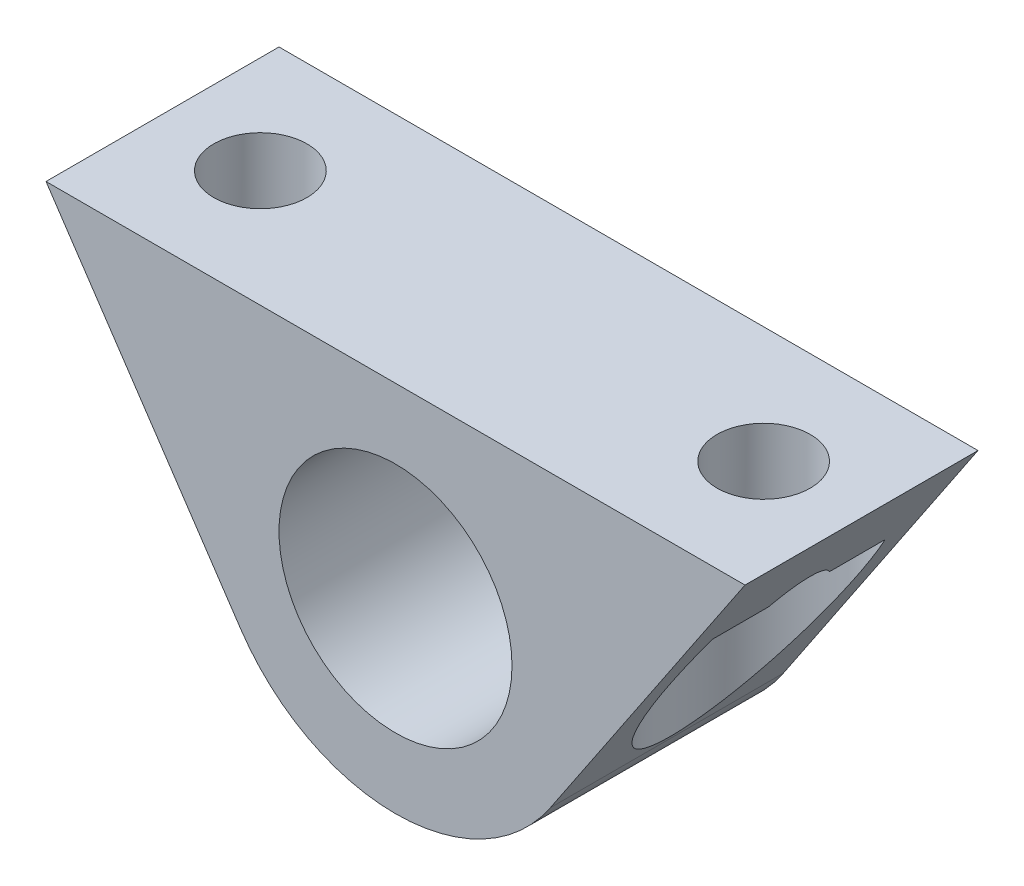
from build123d import *

# Parameters (mm, degrees)
SKETCH1_R           = 2.5
BOSS_EXTRUDE1_DEPTH = 5
CUT_EXTRUDE1_START  = -2
SKETCH2_R           = 2
SKETCH2_R_2         = 1
CUT_EXTRUDE1_DEPTH  = 11.051970793
SKETCH2_2_R         = 1
CUT_EXTRUDE2_DEPTH  = 13.051970793


with BuildPart() as part:
    # Sketch1 → Boss-Extrude1 (new body)
    with BuildSketch(Plane.XY):
        with BuildLine():
            Line((-7.5, 4), (7.5, 4))
            Line((7.5, 4), (3.321799308, -2.228373702))
            ThreePointArc((3.321799308, -2.228373702), (0, -4), (-3.321799308, -2.228373702))
            Line((-3.321799308, -2.228373702), (-7.5, 4))
        make_face()
        Circle(SKETCH1_R, mode=Mode.SUBTRACT)
    extrude(amount=BOSS_EXTRUDE1_DEPTH)

    # Sketch2 → Cut-Extrude1 (cut, through all)
    # profile 1 of 2: a face of its own
    with BuildSketch(Plane(origin=(0, 4, 0), x_dir=(1, 0, 0), z_dir=(0, 1, 0)).offset(CUT_EXTRUDE1_START)):
        with Locations((-5.4, -2.5)):
            Circle(SKETCH2_R)
        with Locations((-5.4, -2.5)):
            Circle(SKETCH2_R_2, mode=Mode.SUBTRACT)
    # profile 2 of 2: a face of its own
    with BuildSketch(Plane(origin=(0, 4, 0), x_dir=(1, 0, 0), z_dir=(0, 1, 0)).offset(CUT_EXTRUDE1_START)):
        with Locations((5.4, -2.5)):
            Circle(SKETCH2_R)
        with Locations((5.4, -2.5)):
            Circle(SKETCH2_R_2, mode=Mode.SUBTRACT)
    extrude(amount=-CUT_EXTRUDE1_DEPTH, mode=Mode.SUBTRACT)

    # Sketch2<2> → Cut-Extrude2 (cut, through all)
    with BuildSketch(Plane(origin=(0, 4, 0), x_dir=(1, 0, 0), z_dir=(0, 1, 0))):
        with Locations((-5.4, -2.5)):
            Circle(SKETCH2_2_R)
        with Locations((5.4, -2.5)):
            Circle(SKETCH2_2_R)
    extrude(amount=-CUT_EXTRUDE2_DEPTH, mode=Mode.SUBTRACT)


solid = part.part
